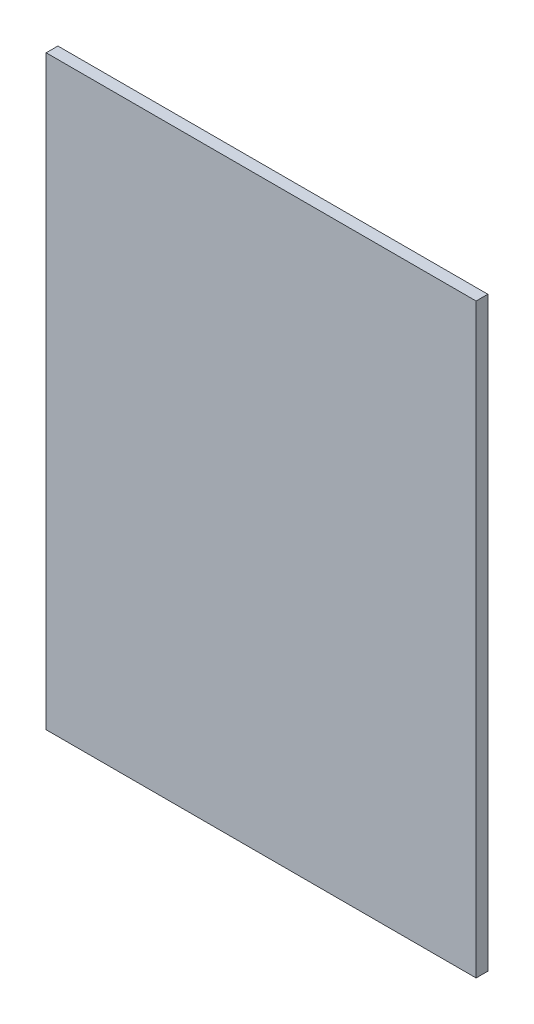
from build123d import *

# Parameters (mm, degrees)
SKETCH1_W           = 110
SKETCH1_H           = 150
BOSS_EXTRUDE1_DEPTH = 3


with BuildPart() as part:
    # Sketch1 → Boss-Extrude1 (new body)
    with BuildSketch(Plane.XY):
        with Locations((14.333333333, 39.333333333)):
            Rectangle(SKETCH1_W, SKETCH1_H)
    extrude(amount=BOSS_EXTRUDE1_DEPTH)


solid = part.part
